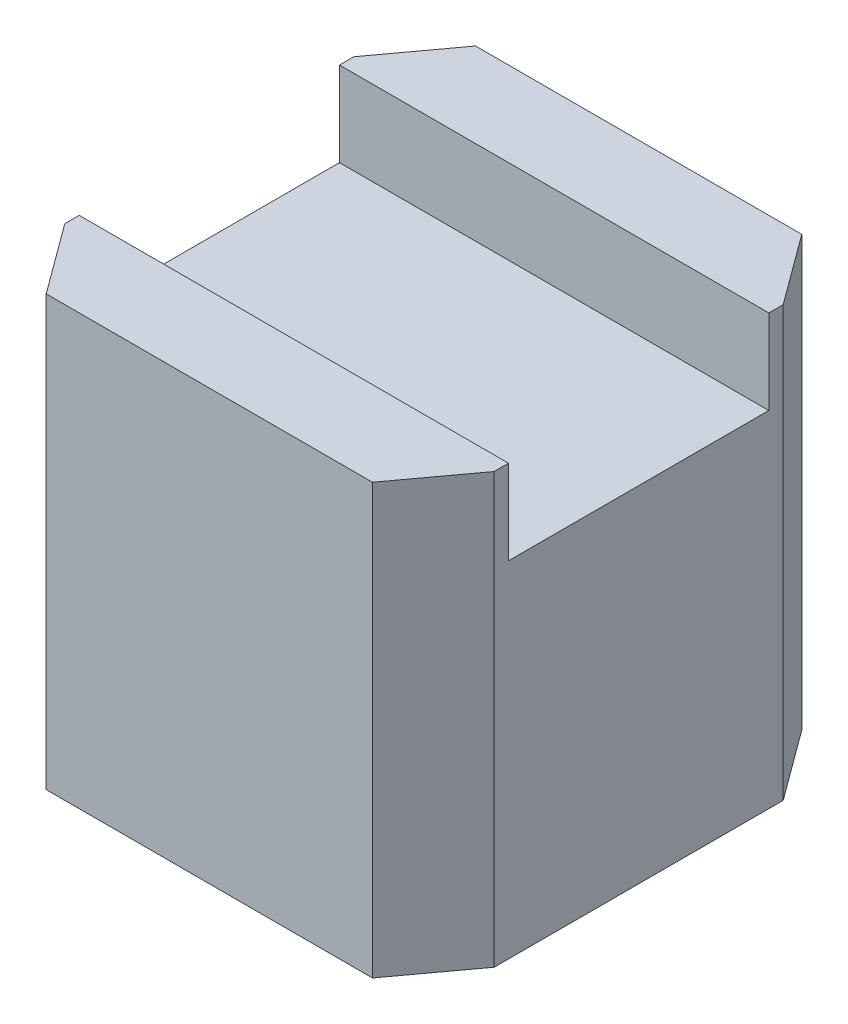
from build123d import *

# Parameters (mm, degrees)
EXTRUDE_1_DEPTH     = 2.54
SKETCH_2_W          = 2.54
SKETCH_2_H          = 1.54
CUT_EXTRUDE_1_DEPTH = 0.5


with BuildPart() as part:
    # Эскиз1 → Бобышка-Вытянуть1 (new body)
    with BuildSketch(Plane(origin=(0, 0, 0), x_dir=(1, 0, 0), z_dir=(0, 1, 0))):
        Polygon((-0.965, 1.27), (-1.27, 0.855), (-1.27, -0.855), (-0.965, -1.27), (0.965, -1.27), (1.27, -0.855), (1.27, 0.855), (0.965, 1.27), align=None)
    extrude(amount=EXTRUDE_1_DEPTH)

    # Эскиз2 → Вырез-Вытянуть1 (cut)
    with BuildSketch(Plane(origin=(0, 2.54, 0), x_dir=(1, 0, 0), z_dir=(0, 1, 0))):
        Rectangle(SKETCH_2_W, SKETCH_2_H)
    extrude(amount=-CUT_EXTRUDE_1_DEPTH, mode=Mode.SUBTRACT)


solid = part.part
